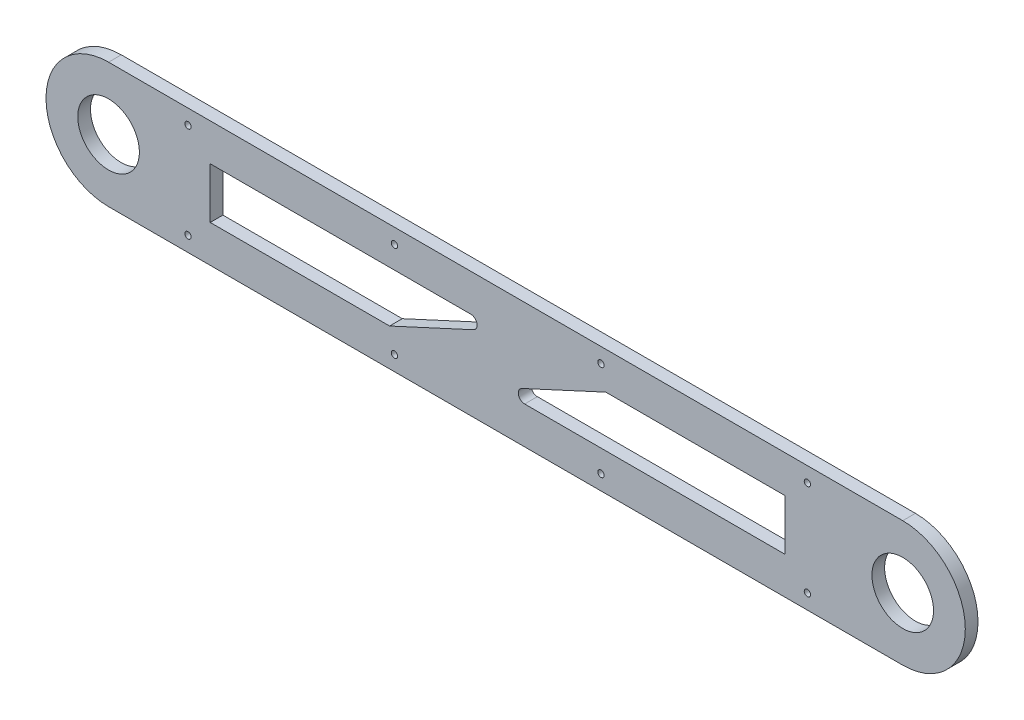
from build123d import *

# Parameters (mm, degrees)
SKETCH_1_R          = 9.7
EXTRUDE_1_DEPTH     = 4
SKETCH_2_R          = 1
CUT_EXTRUDE_1_DEPTH = 10
CUT_EXTRUDE_2_DEPTH = 10


with BuildPart() as part:
    # 草图1 → 凸台-拉伸1 (new body)
    with BuildSketch(Plane.XY):
        with BuildLine():
            Line((0, 19.7), (250, 19.7))
            ThreePointArc((250, 19.7), (269.7, 0), (250, -19.7))
            Line((250, -19.7), (0, -19.7))
            ThreePointArc((0, -19.7), (-19.7, 0), (0, 19.7))
        make_face()
        Circle(SKETCH_1_R, mode=Mode.SUBTRACT)
        with Locations((250, 0)):
            Circle(SKETCH_1_R, mode=Mode.SUBTRACT)
    extrude(amount=EXTRUDE_1_DEPTH)

    # 草图2 → 切除-拉伸1 (cut)
    with BuildSketch(Plane.XY.offset(4)):
        with Locations((25, 15)):
            Circle(SKETCH_2_R)
        with Locations((90, 15)):
            Circle(SKETCH_2_R)
        with Locations((155, 15)):
            Circle(SKETCH_2_R)
        with Locations((220, 15)):
            Circle(SKETCH_2_R)
        with Locations((90, -15)):
            Circle(SKETCH_2_R)
        with Locations((155, -15)):
            Circle(SKETCH_2_R)
        with Locations((220, -15)):
            Circle(SKETCH_2_R)
        with Locations((25, -15)):
            Circle(SKETCH_2_R)
    extrude(amount=-CUT_EXTRUDE_1_DEPTH, mode=Mode.SUBTRACT)

    # 草图3 → 切除-拉伸2 (cut)
    with BuildSketch(Plane.XY.offset(4)):
        with BuildLine():
            Line((32, 8), (114.023268405, 8))
            ThreePointArc((114.023268405, 8), (115.976706085, 6.429046887), (114.86138476, 4.184081231))
            Line((114.86138476, 4.184081231), (88.462542093, -8))
            Line((88.462542093, -8), (32, -8))
            Line((32, -8), (32, 8))
        make_face()
        with BuildLine():
            Line((156.537457907, 8), (130.13861524, -4.184081231))
            ThreePointArc((130.13861524, -4.184081231), (129.023293915, -6.429046887), (130.976731595, -8))
            Line((130.976731595, -8), (213, -8))
            Line((213, -8), (213, 8))
            Line((213, 8), (156.537457907, 8))
        make_face()
    extrude(amount=-CUT_EXTRUDE_2_DEPTH, mode=Mode.SUBTRACT)


solid = part.part
